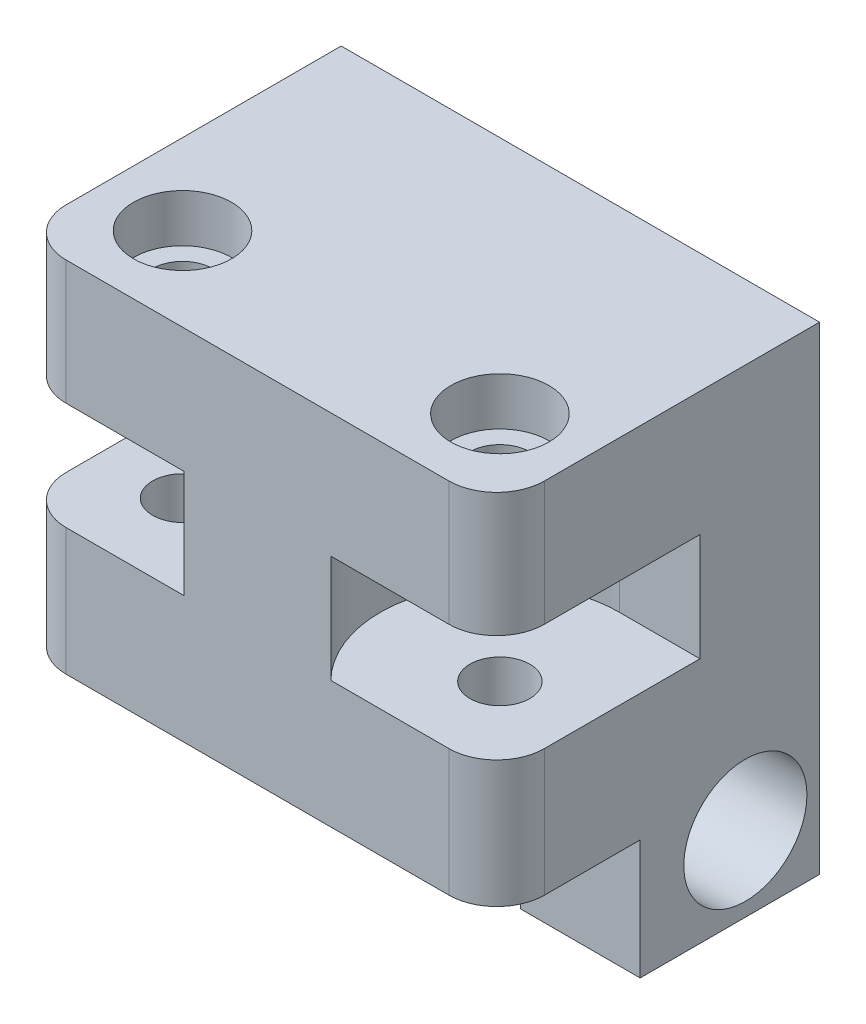
from build123d import *
from build123d.topology import SkipClean

# Parameters (mm, degrees)
SKETCH1_W                = 40
SKETCH1_H                = 27
BOSS_EXTRUDE1_DEPTH      = 30
CUT_EXTRUDE1_DEPTH       = 10
SKETCH3_R                = 2.5
CUT_EXTRUDE2_DEPTH       = 30
CUT_EXTRUDE5_START       = -10.62
CUT_EXTRUDE5_DEPTH       = 9
SKETCH10_W               = 20
SKETCH10_H               = 9
CUT_EXTRUDE7_DEPTH       = 6.8
SKETCH12_W               = 20
SKETCH12_H               = 9
CUT_EXTRUDE10_DEPTH      = 6.8
FILLET1_R                = 4
BOSS_EXTRUDE2_DEPTH      = 40
CUT_EXTRUDE14_DEPTH      = 54.078334793
CUT_EXTRUDE14_DEPTH_BACK = 54.078334793
SKETCH17_R               = 5.15
CUT_EXTRUDE11_REACH      = 42.583
SKETCH14_W               = 20
SKETCH14_H               = 10
SKETCH15_R               = 4.1
CUT_EXTRUDE12_DEPTH      = 4
SKETCH16_R               = 2.5
CUT_EXTRUDE13_DEPTH      = 4


with BuildPart() as part:
    # Sketch1 → Boss-Extrude1 (new body)
    with BuildSketch(Plane(origin=(0, 0, 0), x_dir=(1, 0, 0), z_dir=(0, 1, 0))):
        with Locations((-2.846153846, 4.313186813)):
            Rectangle(SKETCH1_W, SKETCH1_H)
    extrude(amount=BOSS_EXTRUDE1_DEPTH)

    # Sketch2 → Cut-Extrude1 (cut)
    with BuildSketch(Plane(origin=(0, 0, -17.813186813), x_dir=(-1, 0, 0), z_dir=(0, 0, -1))):
        Polygon((-8.086431081, 26), (-8.086431081, 4), (-0.206431081, 4), (-0.206431081, 7), (-2.866431081, 7), (-2.866431081, 8.008707537), (-0.253846154, 10.628707537), (5.946153846, 10.628707537), (8.558738773, 8.008707537), (8.558738773, 7), (5.898738773, 7), (5.898738773, 4), (13.778738773, 4), (13.778738773, 26), (5.898738773, 26), (5.898738773, 23), (8.558738773, 23), (8.558738773, 21.991292463), (5.938738773, 19.378707537), (-0.246431081, 19.378707537), (-2.866431081, 21.991292463), (-2.866431081, 23), (-0.206431081, 23), (-0.206431081, 26), align=None)
    extrude(amount=-CUT_EXTRUDE1_DEPTH, mode=Mode.SUBTRACT)

    # Sketch3 → Cut-Extrude2 (cut)
    with BuildSketch(Plane.XZ):
        with Locations(Location((10.423846154, 2.186813187, 0), (0, 0, 270))):
            Circle(SKETCH3_R)
        with Locations(Location((-16.116153846, 2.186813187, 0), (0, 0, 90))):
            Circle(SKETCH3_R)
    extrude(amount=-CUT_EXTRUDE2_DEPTH, mode=Mode.SUBTRACT)

    # Sketch8 → Cut-Extrude5 (cut)
    with BuildSketch(Plane.XZ.offset(CUT_EXTRUDE5_START)):
        with BuildLine():
            Line((3.282417725, 9.186813187), (17.153846154, 9.186813187))
            Line((17.153846154, 9.186813187), (17.153846154, -7.813186813))
            Line((17.153846154, -7.813186813), (10.423846154, -7.813186813))
            ThreePointArc((10.423846154, -7.813186813), (1.204301697, -1.686170159), (3.282417725, 9.186813187))
        make_face()
        with BuildLine():
            Line((-22.846153846, -7.813186813), (-16.116153846, -7.813186813))
            ThreePointArc((-16.116153846, -7.813186813), (-6.896609389, -1.686170159), (-8.974725418, 9.186813187))
            Line((-8.974725418, 9.186813187), (-22.846153846, 9.186813187))
            Line((-22.846153846, 9.186813187), (-22.846153846, -7.813186813))
        make_face()
    extrude(amount=-CUT_EXTRUDE5_DEPTH, mode=Mode.SUBTRACT)

    # Sketch10 → Cut-Extrude7 (cut)
    with BuildSketch(Plane.ZY.offset(-8.086431081)):
        with Locations((-7.813186813, 15.12)):
            Rectangle(SKETCH10_W, SKETCH10_H)
    extrude(amount=CUT_EXTRUDE7_DEPTH, mode=Mode.SUBTRACT)

    # Sketch12 → Cut-Extrude10 (cut)
    with BuildSketch(Plane(origin=(-13.778738773, 0, 0), x_dir=(0, 0, -1), z_dir=(1, 0, 0))):
        with Locations((7.813186813, 15.12)):
            Rectangle(SKETCH12_W, SKETCH12_H)
    extrude(amount=CUT_EXTRUDE10_DEPTH, mode=Mode.SUBTRACT)

    # Fillet1
    fillet1_edges = [part.edges().sort_by_distance(p)[0] for p in [
        (17.153846154, 24.81, 9.186813187),
        (-22.846153846, 24.81, 9.186813187),
        (17.153846154, 5.31, 9.186813187),
        (-22.846153846, 5.31, 9.186813187),
    ]]
    fillet(fillet1_edges, radius=FILLET1_R)

    # Sketch13 → Boss-Extrude2 (add)
    with BuildSketch(Plane(origin=(17.153846154, 0, 0), x_dir=(0, 0, -1), z_dir=(1, 0, 0))):
        with BuildLine():
            Line((17.813186813, -10), (17.813186813, 0))
            Line((17.813186813, 0), (15.195434711, 0))
            ThreePointArc((15.195434711, 0), (16.355078665, -1.690780832), (16.763186813, -3.7))
            ThreePointArc((16.763186813, -3.7), (9.603967646, -8.441891852), (8.030938916, 0))
            Line((8.030938916, 0), (2.813186813, 0))
            Line((2.813186813, 0), (2.813186813, -10))
            Line((2.813186813, -10), (17.813186813, -10))
        make_face()
    extrude(amount=-BOSS_EXTRUDE2_DEPTH)

    # Sketch17 → Cut-Extrude14 (cut, two sides: drawn at the far end of the back side and taken through both)
    with SkipClean():  # the faces are left unmerged after this step: merging them gives an invalid solid
        with BuildSketch(Plane(origin=(17.153846154, 0, 0), x_dir=(0, 0, -1), z_dir=(1, 0, 0)).offset(-CUT_EXTRUDE14_DEPTH_BACK)):
            with Locations((11.613186813, -3.7)):
                Circle(SKETCH17_R)
        extrude(amount=CUT_EXTRUDE14_DEPTH + CUT_EXTRUDE14_DEPTH_BACK, mode=Mode.SUBTRACT)

    # Sketch14 → Cut-Extrude11 (cut, up to next)
    with BuildSketch(Plane.XY.offset(-2.813186813), mode=Mode.PRIVATE) as cut_extrude11_sk1:
        with Locations((-2.846153846, -5)):
            Rectangle(SKETCH14_W, SKETCH14_H)
    cut_extrude11_tool1 = extrude(cut_extrude11_sk1.sketch, amount=-CUT_EXTRUDE11_REACH, mode=Mode.PRIVATE) & part.part
    add(cut_extrude11_tool1.solids().sort_by_distance((-2.846154, -5, -2.813187))[0], mode=Mode.SUBTRACT)

    # Sketch15 → Cut-Extrude12 (cut)
    with SkipClean():  # the faces are left unmerged after this step: merging them gives an invalid solid
        with BuildSketch(Plane(origin=(0, 30, 0), x_dir=(1, 0, 0), z_dir=(0, 1, 0))):
            with Locations(Location((-16.116153846, -2.186813187, 0), (0, 0, 270))):
                Circle(SKETCH15_R)
            with Locations(Location((10.423846154, -2.186813187, 0), (0, 0, 90))):
                Circle(SKETCH15_R)
        extrude(amount=-CUT_EXTRUDE12_DEPTH, mode=Mode.SUBTRACT)

    # Sketch16 → Cut-Extrude13 (cut)
    # profile 1 of 2: a face of its own
    with SkipClean():  # the faces are left unmerged after this step: merging them gives an invalid solid
        with BuildSketch(Plane.XZ):
            Polygon((-13.749017742, -1.913186813), (-11.381881639, 2.186813187), (-13.749017742, 6.286813187), (-18.48328995, 6.286813187), (-20.850426054, 2.186813187), (-18.48328995, -1.913186813), align=None)
            with Locations(Location((-16.116153846, 2.186813187, 0), (0, 0, 270))):
                Circle(SKETCH16_R, mode=Mode.SUBTRACT)
        # profile 2 of 2: a face of its own
        with BuildSketch(Plane.XZ):
            Polygon((12.790982258, -1.913186813), (15.158118361, 2.186813187), (12.790982258, 6.286813187), (8.05671005, 6.286813187), (5.689573946, 2.186813187), (8.05671005, -1.913186813), align=None)
            with Locations(Location((10.423846154, 2.186813187, 0), (0, 0, 270))):
                Circle(SKETCH16_R, mode=Mode.SUBTRACT)
        extrude(amount=-CUT_EXTRUDE13_DEPTH, mode=Mode.SUBTRACT)


solid = part.part
